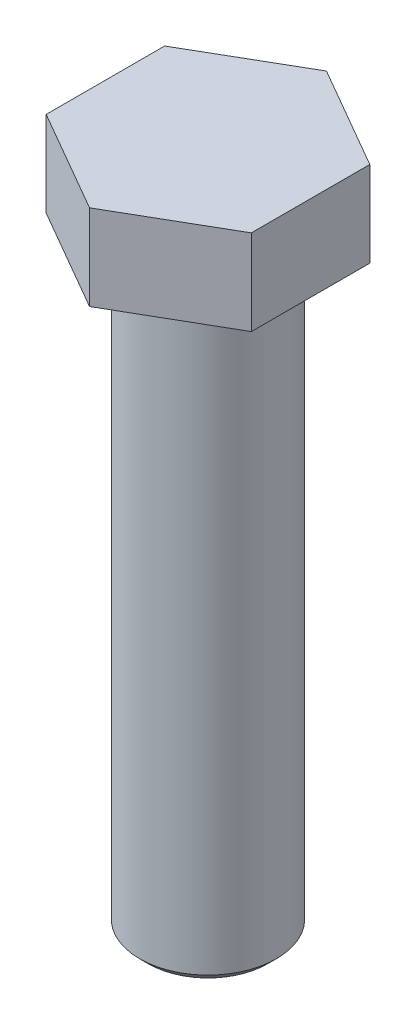
from build123d import *

# Parameters (mm, degrees)
SKETCH1_R           = 4
BOSS_EXTRUDE1_DEPTH = 35
BOSS_EXTRUDE2_DEPTH = 5
CHAMFER1_SIZE       = 0.5


with BuildPart() as part:
    # Sketch1 → Boss-Extrude1 (new body)
    with BuildSketch(Plane(origin=(0, 0, 0), x_dir=(1, 0, 0), z_dir=(0, 1, 0))):
        with Locations(Location((0, 0, 0), (0, 0, 270))):
            Circle(SKETCH1_R)
    extrude(amount=BOSS_EXTRUDE1_DEPTH)

    # Sketch2 → Boss-Extrude2 (add)
    with BuildSketch(Plane(origin=(0, 35, 0), x_dir=(1, 0, 0), z_dir=(0, 1, 0))):
        Polygon((6, 3.464101615), (0, 6.92820323), (-6, 3.464101615), (-6, -3.464101615), (0, -6.92820323), (6, -3.464101615), align=None)
    extrude(amount=BOSS_EXTRUDE2_DEPTH)

    # Chamfer1
    chamfer1_edges = [part.edges().sort_by_distance(p)[0] for p in [
        (0, 0, -4),
    ]]
    chamfer(chamfer1_edges, length=CHAMFER1_SIZE)


solid = part.part
